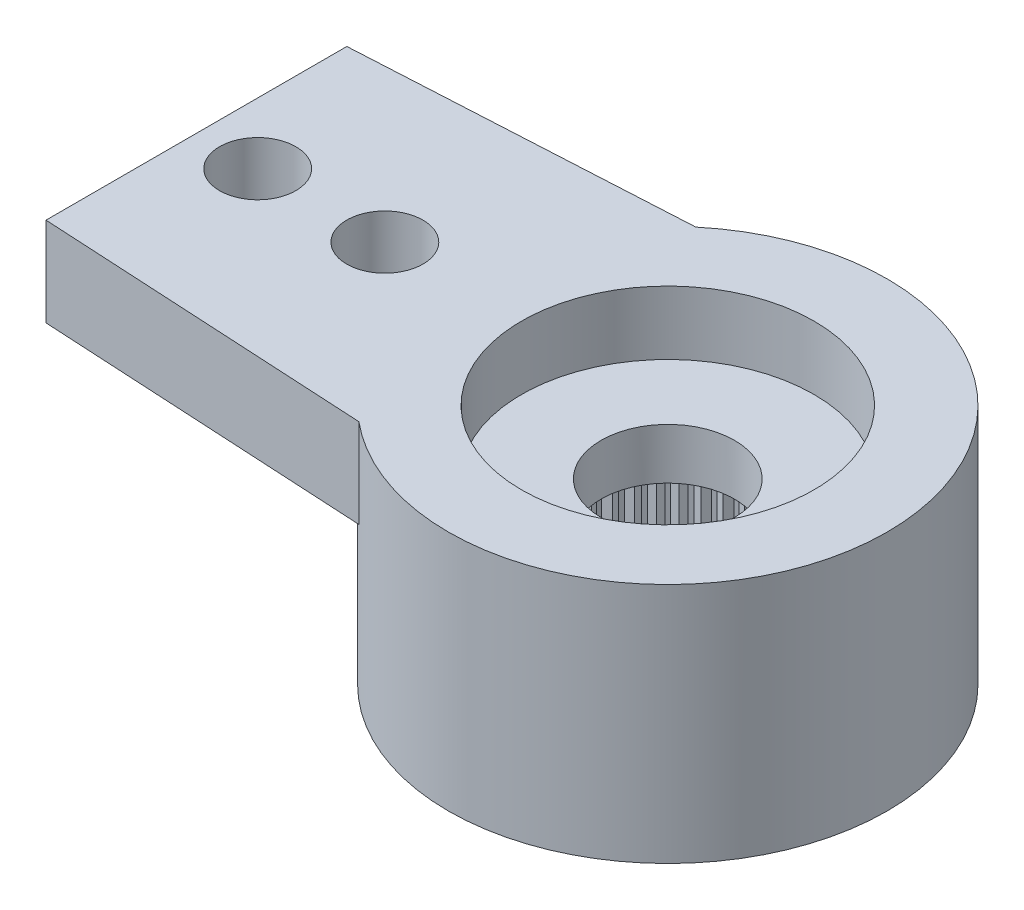
from build123d import *

# Parameters (mm, degrees)
RESSALTO_EXTRUS_O1_DEPTH = 1.4
ESBO_O2_R                = 3.45
RESSALTO_EXTRUS_O2_DEPTH = 2.4
FURO4_D                  = 1.2
PADR_O_LINEAR1_COUNT     = 6
PADR_O_LINEAR1_PITCH     = 2
FURO1_D                  = 4.95
FURO1_DEPTH              = 2
FURO2_D                  = 4.6
FURO2_DEPTH              = 1
FURO3_D                  = 2.1
RESSALTO_EXTRUS_O3_START = -2
RESSALTO_EXTRUS_O3_DEPTH = 2
PADR_OCIRCULAR1_COUNT    = 60
CUT_EXTRUDE1_DEPTH       = 17.850667643
CUT_EXTRUDE1_DEPTH_BACK  = 17.850667643
SKETCH1_W                = 8.867740583
SKETCH1_H                = 7.733006006


with BuildPart() as part:
    # Esboço1 → Ressalto-extrusão1 (new body)
    with BuildSketch(Plane(origin=(0, 0, 0), x_dir=(1, 0, 0), z_dir=(0, 1, 0))):
        with BuildLine():
            Line((-14.159121967, 1.99702088), (-2.209072203, 2.65))
            ThreePointArc((-2.209072203, 2.65), (3.45, 0), (-2.209072203, -2.65))
            Line((-2.209072203, -2.65), (-14.159121967, -1.99702088))
            ThreePointArc((-14.159121967, -1.99702088), (-16.05, 0), (-14.159121967, 1.99702088))
        make_face()
    extrude(amount=-RESSALTO_EXTRUS_O1_DEPTH)

    # Esboço2 → Ressalto-extrusão2 (add)
    with BuildSketch(Plane.XZ.offset(1.4)):
        with Locations(Location((0, 0, 0), (0, 0, 90))):
            Circle(ESBO_O2_R)
    extrude(amount=RESSALTO_EXTRUS_O2_DEPTH)

    # Furo4 (through all)
    with Locations(Plane(origin=(0, 0, 0), x_dir=(1, 0, 0), z_dir=(0, 1, 0))):
        with Locations((-14.45, 0)):
            furo4 = Hole(FURO4_D / 2)

    # Padrão linear1: Furo4 ×6
    with Locations(*[(i * PADR_O_LINEAR1_PITCH, 0, 0) for i in range(1, PADR_O_LINEAR1_COUNT)]):
        add(furo4, mode=Mode.SUBTRACT)

    # Furo1
    with Locations(Plane(origin=(0, -3.8, 0), x_dir=(-1, 0, 0), z_dir=(0, -1, 0))):
        with Locations((0, 0)):
            Hole(FURO1_D / 2, depth=FURO1_DEPTH)

    # Furo2
    with Locations(Plane(origin=(0, 0, 0), x_dir=(1, 0, 0), z_dir=(0, 1, 0))):
        with Locations((0, 0)):
            Hole(FURO2_D / 2, depth=FURO2_DEPTH)

    # Furo3 (through all)
    with Locations(Plane(origin=(0, 0, 0), x_dir=(1, 0, 0), z_dir=(0, 1, 0))):
        with Locations((0, 0)):
            Hole(FURO3_D / 2)

    # Esboço11 → Ressalto-extrusão3 (add)
    with BuildSketch(Plane.XZ.offset(3.8).offset(RESSALTO_EXTRUS_O3_START)):
        with BuildLine():
            Line((-0.098056786, 2.473056786), (0, 2.375))
            Line((0, 2.375), (0.098056786, 2.473056786))
            ThreePointArc((0.098056786, 2.473056786), (0, 2.475), (-0.098056786, 2.473056786))
        make_face()
    ressalto_extrus_o3 = extrude(amount=RESSALTO_EXTRUS_O3_DEPTH)

    # PadrãoCircular1: Ressalto-extrusão3 ×60 about axis
    padr_ocircular1_axis = Axis((0, 0, 0), (0, 1, 0))
    for i in range(1, PADR_OCIRCULAR1_COUNT):
        add(ressalto_extrus_o3.rotate(padr_ocircular1_axis, i * 360 / PADR_OCIRCULAR1_COUNT))

    # Sketch1 → Cut-Extrude1 (cut, two sides: drawn at the far end of the back side and taken through both)
    with BuildSketch(Plane(origin=(0, 0, 0), x_dir=(1, 0, 0), z_dir=(0, 1, 0)).offset(-CUT_EXTRUDE1_DEPTH_BACK)):
        with Locations((-11.847591266, -0.409765264)):
            Rectangle(SKETCH1_W, SKETCH1_H)
    extrude(amount=CUT_EXTRUDE1_DEPTH + CUT_EXTRUDE1_DEPTH_BACK, mode=Mode.SUBTRACT)


solid = part.part
